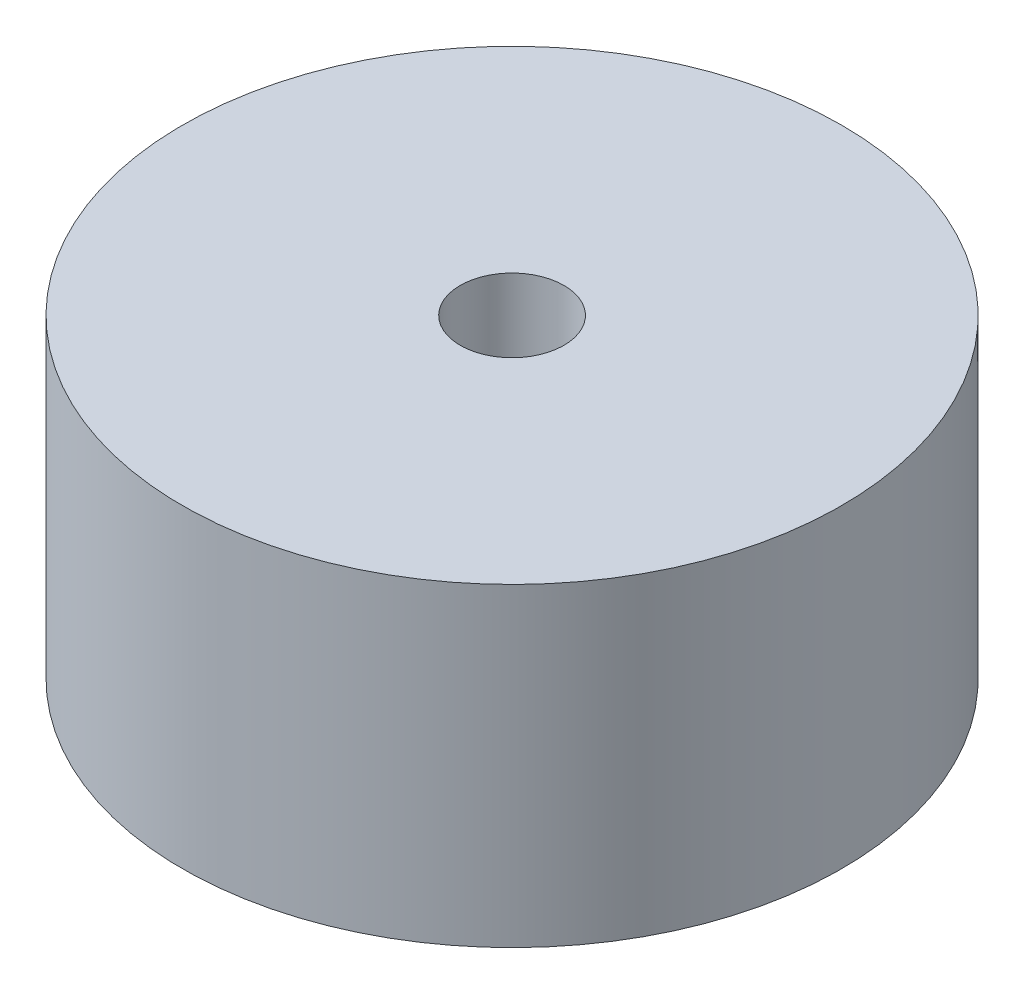
from build123d import *

# Parameters (mm, degrees)
SKETCH1_R           = 31.75
BOSS_EXTRUDE1_DEPTH = 30.3
SKETCH2_R           = 5
CUT_EXTRUDE1_DEPTH  = 55.168394844


with BuildPart() as part:
    # Sketch1 → Boss-Extrude1 (new body)
    with BuildSketch(Plane(origin=(0, 0, 0), x_dir=(1, 0, 0), z_dir=(0, 1, 0))):
        with Locations(Location((0, 0, 0), (0, 0, 90))):
            Circle(SKETCH1_R)
    extrude(amount=BOSS_EXTRUDE1_DEPTH)

    # Sketch2 → Cut-Extrude1 (cut, through all)
    with BuildSketch(Plane.XZ):
        with Locations(Location((0, 0, 0), (0, 0, 270))):
            Circle(SKETCH2_R)
    extrude(amount=-CUT_EXTRUDE1_DEPTH, mode=Mode.SUBTRACT)


solid = part.part
